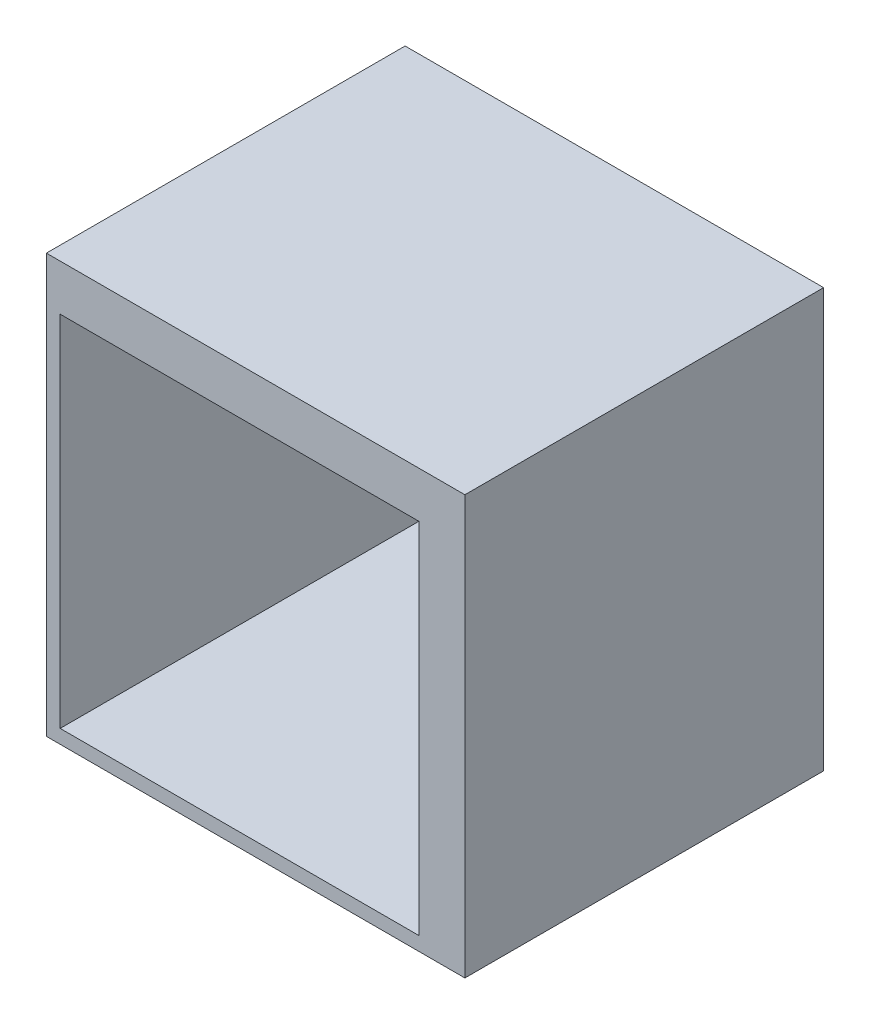
from build123d import *

# Parameters (mm, degrees)
ESQUISSE1_W        = 455
ESQUISSE1_H        = 455
ESQUISSE1_W_2      = 390
ESQUISSE1_H_2      = 390
BOSS_EXTRU_1_DEPTH = 390


with BuildPart() as part:
    # Esquisse1 → Boss.-Extru.1 (new body)
    with BuildSketch(Plane.XY):
        with Locations((118.129055567, 170.747624559)):
            Rectangle(ESQUISSE1_W, ESQUISSE1_H)
        with Locations((100.629055567, 153.247624559)):
            Rectangle(ESQUISSE1_W_2, ESQUISSE1_H_2, mode=Mode.SUBTRACT)
    extrude(amount=BOSS_EXTRU_1_DEPTH)


solid = part.part
